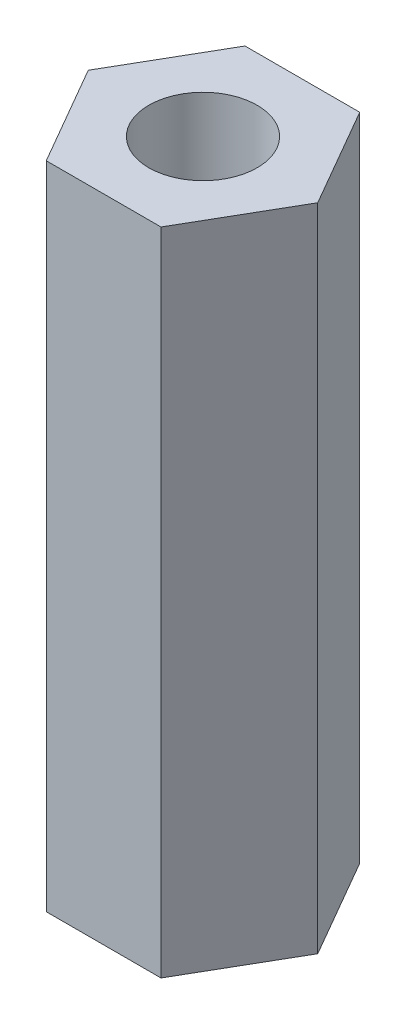
from build123d import *

# Parameters (mm, degrees)
SKETCH_1_R      = 1.5
EXTRUDE_1_DEPTH = 18


with BuildPart() as part:
    # 草图1 → 凸台-拉伸1 (new body)
    with BuildSketch(Plane(origin=(0, 0, 0), x_dir=(1, 0, 0), z_dir=(0, 1, 0))):
        Polygon((3.175426481, 0), (1.58771324, 2.75), (-1.58771324, 2.75), (-3.175426481, 0), (-1.58771324, -2.75), (1.58771324, -2.75), align=None)
        with Locations(Location((0, 0, 0), (0, 0, 270))):
            Circle(SKETCH_1_R, mode=Mode.SUBTRACT)
    extrude(amount=EXTRUDE_1_DEPTH)


solid = part.part
